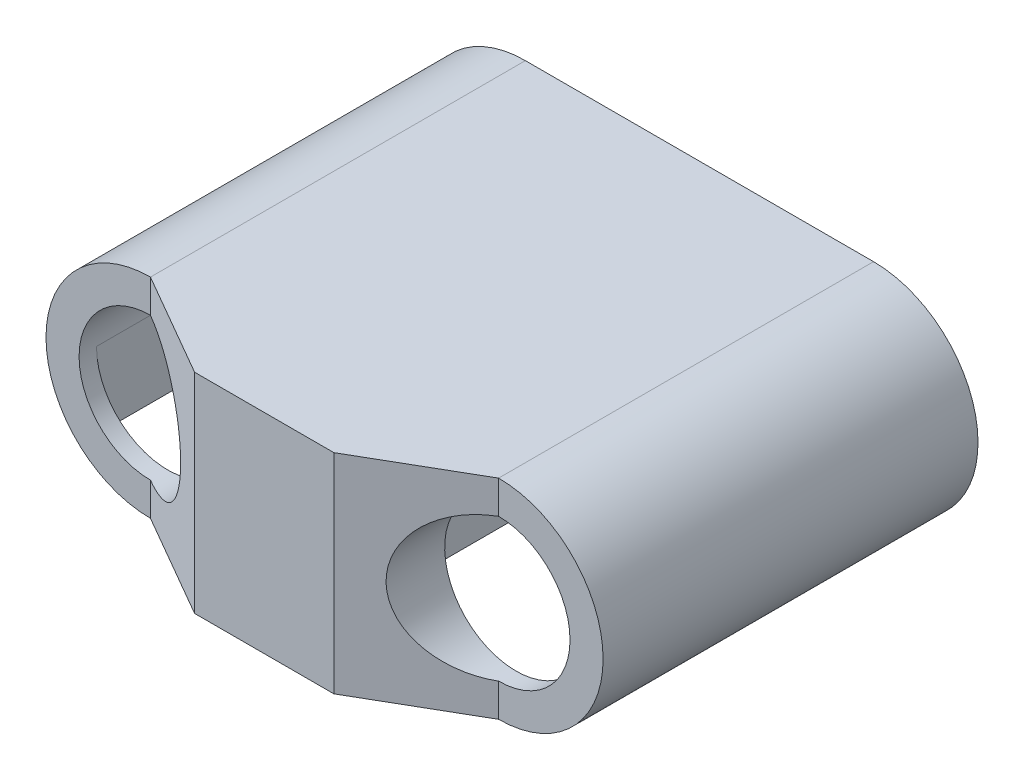
from build123d import *

# Parameters (mm, degrees)
SKETCH1_R           = 41
BOSS_EXTRUDE1_DEPTH = 250
CUT_EXTRUDE2_DEPTH  = 130
CUT_EXTRUDE3_DEPTH  = 205.358983849
FILLET1_R           = 5


with BuildPart() as part:
    # Sketch1 → Boss-Extrude1 (new body)
    with BuildSketch(Plane.XY):
        with BuildLine():
            Line((-100, 60), (100, 60))
            ThreePointArc((100, 60), (160, 0), (100, -60))
            Line((100, -60), (-100, -60))
            ThreePointArc((-100, -60), (-160, 0), (-100, 60))
        make_face()
        with Locations((100, 0)):
            Circle(SKETCH1_R, mode=Mode.SUBTRACT)
        with Locations(Location((-100, 0, 0), (0, 0, 180))):
            Circle(SKETCH1_R, mode=Mode.SUBTRACT)
    extrude(amount=BOSS_EXTRUDE1_DEPTH)

    # Sketch5 → Cut-Extrude2 (cut, symmetric)
    with BuildSketch(Plane(origin=(0, 0, 0), x_dir=(1, 0, 0), z_dir=(0, 1, 0))):
        Polygon((100, -215.358983849), (40, -250), (-40, -250), (-100, -215.358983849), (-160, -215.358983849), (-160, -312.331187037), (-8.326687978, -312.331187037), (8.326687978, -312.331187037), (160, -312.331187037), (160, -215.358983849), align=None)
    extrude(amount=CUT_EXTRUDE2_DEPTH, both=True, mode=Mode.SUBTRACT)

    # Sketch7 → Cut-Extrude3 (cut)
    with BuildSketch(Plane(origin=(0, 0, 0), x_dir=(-1, 0, 0), z_dir=(0, 0, -1))):
        with BuildLine():
            Line((100, 41), (5, 41))
            Line((5, 41), (5, -85.727890399))
            Line((5, -85.727890399), (141, -85.727890399))
            Line((141, -85.727890399), (141, 0))
            ThreePointArc((141, 0), (128.991378029, 28.991378029), (100, 41))
        make_face()
        with BuildLine():
            Line((-141, 0), (-141, -85.727890399))
            Line((-141, -85.727890399), (-5, -85.727890399))
            Line((-5, -85.727890399), (-5, 41))
            Line((-5, 41), (-100, 41))
            ThreePointArc((-100, 41), (-128.991378029, 28.991378029), (-141, 0))
        make_face()
    extrude(amount=-CUT_EXTRUDE3_DEPTH, mode=Mode.SUBTRACT)

    # Fillet1
    fillet1_edges = [part.edges().sort_by_distance(p)[0] for p in [
        (5, -9.5, 205.358983849),
        (5, 41, 102.679491924),
        (-5, -9.5, 205.358983849),
        (-5, 41, 102.679491924),
    ]]
    fillet(fillet1_edges, radius=FILLET1_R)


solid = part.part
